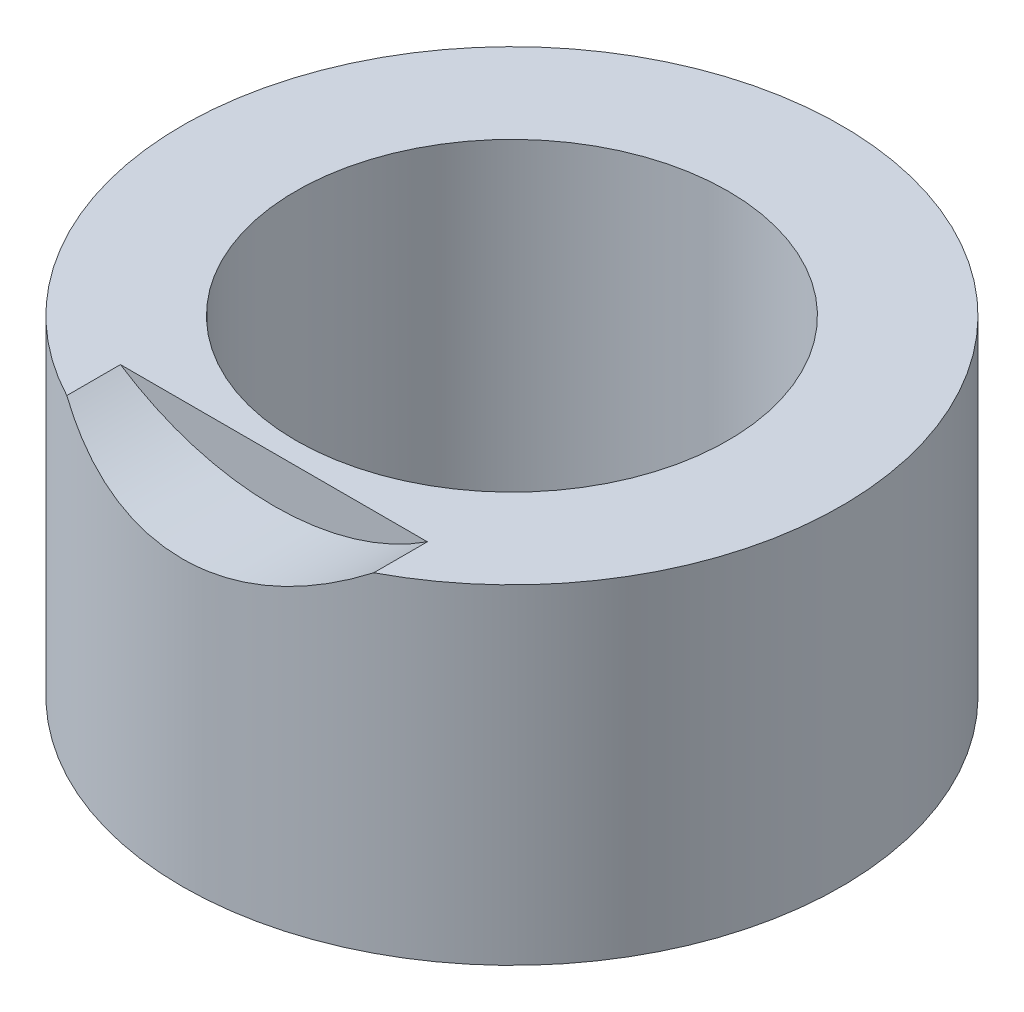
from build123d import *

# Parameters (mm, degrees)
SKETCH1_R               = 9
SKETCH1_R_2             = 5.9
BOSS_EXTRUDE1_DEPTH     = 23.8
CUT_EXTRUDE5_START      = 6.5
SKETCH3_R               = 7.65
CUT_EXTRUDE5_DEPTH      = 21.489627637
CUT_EXTRUDE6_DEPTH      = 30.7941271
CUT_EXTRUDE6_DEPTH_BACK = 7
SKETCH6_R               = 5.5
SKETCH7_R               = 13.484313598
CUT_EXTRUDE7_DEPTH      = 20.520246068


with BuildPart() as part:
    # Sketch1 → Boss-Extrude1 (new body)
    with BuildSketch(Plane(origin=(0, 0, 0), x_dir=(1, 0, 0), z_dir=(0, 1, 0))):
        with Locations(Location((0, 0, 0), (0, 0, 270))):
            Circle(SKETCH1_R)
        with Locations(Location((0, 0, 0), (0, 0, 270))):
            Circle(SKETCH1_R_2, mode=Mode.SUBTRACT)
    extrude(amount=-BOSS_EXTRUDE1_DEPTH)

    # Sketch3 → Cut-Extrude5 (cut, through all)
    with BuildSketch(Plane.XY.offset(CUT_EXTRUDE5_START)):
        with Locations((0, -8.4)):
            Circle(SKETCH3_R)
    extrude(amount=CUT_EXTRUDE5_DEPTH, mode=Mode.SUBTRACT)

    # Sketch6 → Cut-Extrude6 (cut, two sides: drawn at the far end of the back side and taken through both)
    with BuildSketch(Plane.XY.offset(6.5).offset(-CUT_EXTRUDE6_DEPTH_BACK)):
        with Locations(Location((0.145476138, -8.4, 0), (0, 0, 91.515662264))):
            Circle(SKETCH6_R)
    extrude(amount=CUT_EXTRUDE6_DEPTH + CUT_EXTRUDE6_DEPTH_BACK, mode=Mode.SUBTRACT)

    # Sketch7 → Cut-Extrude7 (cut, through all)
    with BuildSketch(Plane(origin=(0, -14.8, 0), x_dir=(-1, 0, 0), z_dir=(0, -1, 0))):
        Circle(SKETCH7_R)
    extrude(amount=-CUT_EXTRUDE7_DEPTH, mode=Mode.SUBTRACT)


solid = part.part
